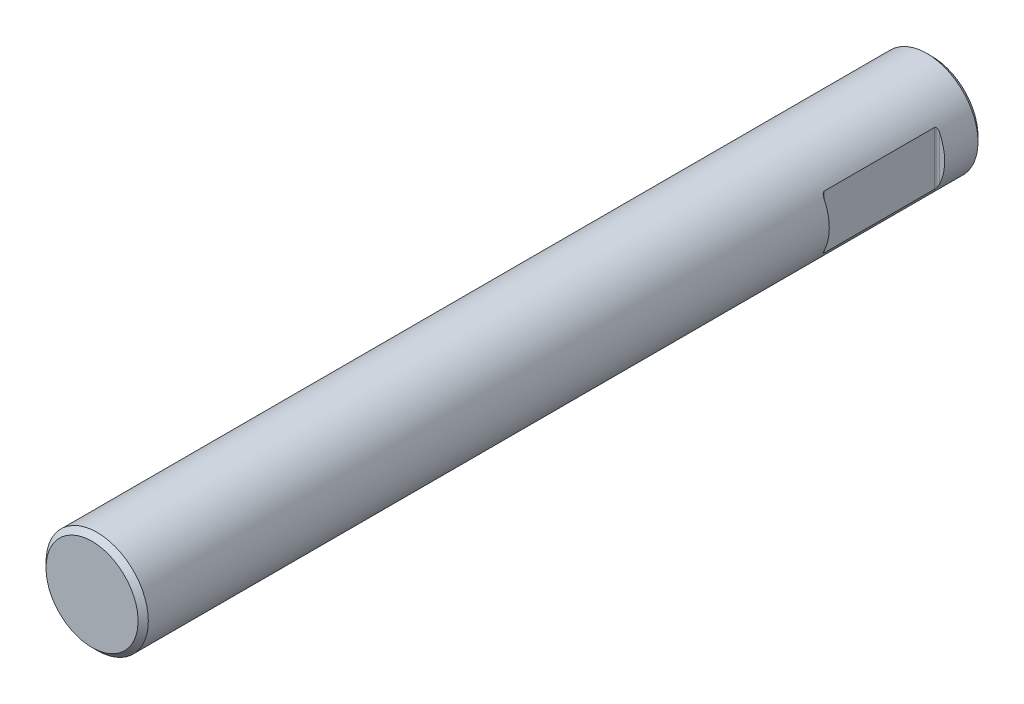
from build123d import *

# Parameters (mm, degrees)
SKIZZE1_W                            = 32.76
SKIZZE1_H                            = 1.995
FASE1_SIZE                           = 0.2
SCHNITT_LINEAR_AUSTRAGEN1_DEPTH      = 33.881265943
SCHNITT_LINEAR_AUSTRAGEN1_DEPTH_BACK = 33.881265943


with BuildPart() as part:
    # Skizze1 → Rotation1 (revolve)
    with BuildSketch(Plane(origin=(0, 0, 0), x_dir=(0, 0, -1), z_dir=(1, 0, 0))):
        with Locations((16.38, 0.9975)):
            Rectangle(SKIZZE1_W, SKIZZE1_H)
    revolve(axis=Axis((0, 0, 50.516901408), (0, 0, -1)))

    # Fase1
    fase1_edges = [part.edges().sort_by_distance(p)[0] for p in [
        (0, -1.995, -32.76),
        (0, -1.995, 0),
    ]]
    chamfer(fase1_edges, length=FASE1_SIZE)

    # Skizze2 → Schnitt-Linear austragen1 (cut, two sides: drawn at the far end of the back side and taken through both)
    with BuildSketch(Plane(origin=(0, 0, 0), x_dir=(1, 0, 0), z_dir=(0, 1, 0)).offset(-SCHNITT_LINEAR_AUSTRAGEN1_DEPTH_BACK)):
        with BuildLine():
            Line((-6.2, 26.76), (-1.8, 26.76))
            ThreePointArc((-1.8, 26.76), (-1.729289322, 26.789289322), (-1.7, 26.86))
            Line((-1.7, 26.86), (-1.7, 31.16))
            ThreePointArc((-1.7, 31.16), (-1.729289322, 31.230710678), (-1.8, 31.26))
            Line((-1.8, 31.26), (-6.2, 31.26))
            Line((-6.2, 31.26), (-6.2, 26.76))
        make_face()
        with BuildLine():
            Line((1.7, 26.86), (1.7, 31.16))
            ThreePointArc((1.7, 31.16), (1.729289322, 31.230710678), (1.8, 31.26))
            Line((1.8, 31.26), (6.2, 31.26))
            Line((6.2, 31.26), (6.2, 26.76))
            Line((6.2, 26.76), (1.8, 26.76))
            ThreePointArc((1.8, 26.76), (1.729289322, 26.789289322), (1.7, 26.86))
        make_face()
    extrude(amount=SCHNITT_LINEAR_AUSTRAGEN1_DEPTH + SCHNITT_LINEAR_AUSTRAGEN1_DEPTH_BACK, mode=Mode.SUBTRACT)


solid = part.part
